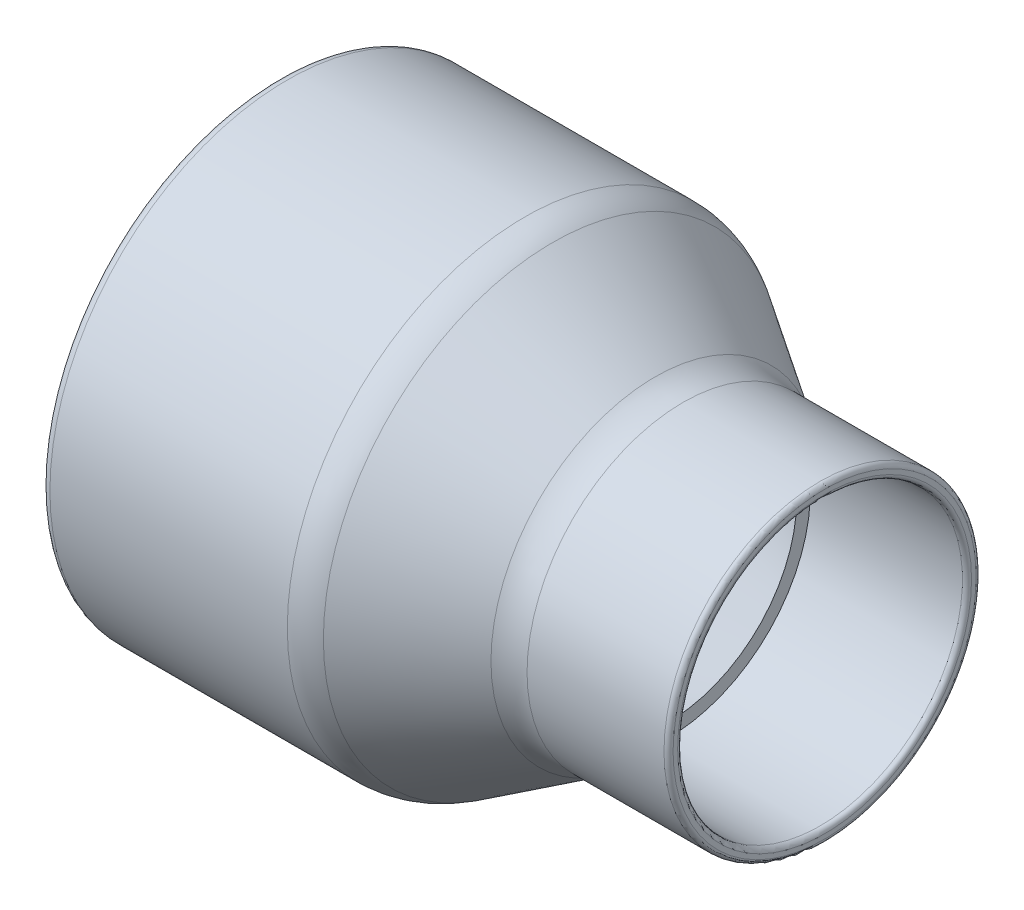
from build123d import *


with BuildPart() as part:
    # Эскиз1 → Повернуть1 (revolve)
    with BuildSketch(Plane.XY):
        with BuildLine():
            Line((-72, 60), (-72, 57.5))
            ThreePointArc((-72, 57.5), (-71.267766953, 55.732233047), (-69.5, 55))
            Line((-69.5, 55), (-4.2, 55))
            ThreePointArc((-4.2, 55), (-3.351471863, 54.648528137), (-3, 53.8))
            Line((-3, 53.8), (-3, 51.4))
            Line((-3, 51.4), (30.75, 33.9))
            Line((30.75, 33.9), (30.75, 37.5))
            Line((30.75, 37.5), (70.8, 37.5))
            ThreePointArc((70.8, 37.5), (71.648528137, 37.851471863), (72, 38.7))
            Line((72, 38.7), (72, 39.9))
            ThreePointArc((72, 39.9), (71.648528137, 40.748528137), (70.8, 41.1))
            Line((70.8, 41.1), (34.741845976, 41.1))
            ThreePointArc((34.741845976, 41.1), (30.908285073, 41.645216366), (27.378741647, 43.237627519))
            Line((27.378741647, 43.237627519), (0.371258353, 60.362372481))
            ThreePointArc((0.371258353, 60.362372481), (-3.158285073, 61.954783634), (-6.991845976, 62.5))
            Line((-6.991845976, 62.5), (-69.5, 62.5))
            ThreePointArc((-69.5, 62.5), (-71.267766953, 61.767766953), (-72, 60))
        make_face()
    revolve(axis=Axis((-72, 0, 0), (1, 0, 0)))


solid = part.part
